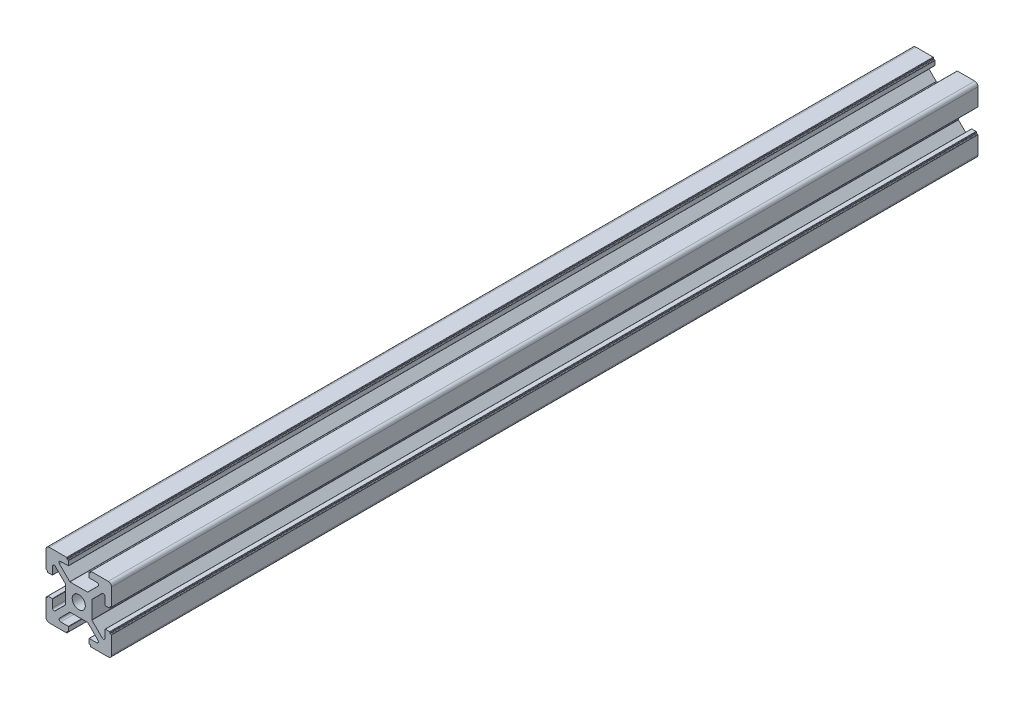
from build123d import *

# Parameters (mm, degrees)
SKETCH1_R           = 2
BOSS_EXTRUDE1_DEPTH = 264.5


with BuildPart() as part:
    # Sketch1 → Boss-Extrude1 (new body)
    with BuildSketch(Plane.XY):
        with BuildLine():
            Line((-10, 9), (-10, 3.7))
            ThreePointArc((-10, 3.7), (-9.970710678, 3.629289322), (-9.9, 3.6))
            Line((-9.9, 3.6), (-9.6, 3.6))
            ThreePointArc((-9.6, 3.6), (-9.529289322, 3.570710678), (-9.5, 3.5))
            Line((-9.5, 3.5), (-9.5, 3.2))
            ThreePointArc((-9.5, 3.2), (-9.470710678, 3.129289322), (-9.4, 3.1))
            Line((-9.4, 3.1), (-8.1, 3.1))
            ThreePointArc((-8.1, 3.1), (-8.029289322, 3.129289322), (-8, 3.2))
            Line((-8, 3.2), (-8, 5.520101013))
            ThreePointArc((-8, 5.520101013), (-7.691341716, 5.982040779), (-7.146446609, 5.873654403))
            Line((-7.146446609, 5.873654403), (-4.029289322, 2.756497116))
            ThreePointArc((-4.029289322, 2.756497116), (-4.007612047, 2.724054781), (-4, 2.685786438))
            Line((-4, 2.685786438), (-4, 0))
            Line((-4, 0), (-4, -2.685786438))
            ThreePointArc((-4, -2.685786438), (-4.007612047, -2.724054781), (-4.029289322, -2.756497116))
            Line((-4.029289322, -2.756497116), (-7.146446609, -5.873654403))
            ThreePointArc((-7.146446609, -5.873654403), (-7.691341716, -5.982040779), (-8, -5.520101013))
            Line((-8, -5.520101013), (-8, -3.2))
            ThreePointArc((-8, -3.2), (-8.029289322, -3.129289322), (-8.1, -3.1))
            Line((-8.1, -3.1), (-9.4, -3.1))
            ThreePointArc((-9.4, -3.1), (-9.470710678, -3.129289322), (-9.5, -3.2))
            Line((-9.5, -3.2), (-9.5, -3.5))
            ThreePointArc((-9.5, -3.5), (-9.529289322, -3.570710678), (-9.6, -3.6))
            Line((-9.6, -3.6), (-9.9, -3.6))
            ThreePointArc((-9.9, -3.6), (-9.970710678, -3.629289322), (-10, -3.7))
            Line((-10, -3.7), (-10, -9))
            ThreePointArc((-10, -9), (-9.707106781, -9.707106781), (-9, -10))
            Line((-9, -10), (-3.7, -10))
            ThreePointArc((-3.7, -10), (-3.629289322, -9.970710678), (-3.6, -9.9))
            Line((-3.6, -9.9), (-3.6, -9.6))
            ThreePointArc((-3.6, -9.6), (-3.570710678, -9.529289322), (-3.5, -9.5))
            Line((-3.5, -9.5), (-3.2, -9.5))
            ThreePointArc((-3.2, -9.5), (-3.129289322, -9.470710678), (-3.1, -9.4))
            Line((-3.1, -9.4), (-3.1, -8.1))
            ThreePointArc((-3.1, -8.1), (-3.129289322, -8.029289322), (-3.2, -8))
            Line((-3.2, -8), (-5.520101013, -8))
            ThreePointArc((-5.520101013, -8), (-5.982040779, -7.691341716), (-5.873654403, -7.146446609))
            Line((-5.873654403, -7.146446609), (-2.756497116, -4.029289322))
            ThreePointArc((-2.756497116, -4.029289322), (-2.724054781, -4.007612047), (-2.685786438, -4))
            Line((-2.685786438, -4), (2.685786438, -4))
            ThreePointArc((2.685786438, -4), (2.724054781, -4.007612047), (2.756497116, -4.029289322))
            Line((2.756497116, -4.029289322), (5.873654403, -7.146446609))
            ThreePointArc((5.873654403, -7.146446609), (5.982040779, -7.691341716), (5.520101013, -8))
            Line((5.520101013, -8), (3.2, -8))
            ThreePointArc((3.2, -8), (3.129289322, -8.029289322), (3.1, -8.1))
            Line((3.1, -8.1), (3.1, -9.4))
            ThreePointArc((3.1, -9.4), (3.129289322, -9.470710678), (3.2, -9.5))
            Line((3.2, -9.5), (3.5, -9.5))
            ThreePointArc((3.5, -9.5), (3.570710678, -9.529289322), (3.6, -9.6))
            Line((3.6, -9.6), (3.6, -9.9))
            ThreePointArc((3.6, -9.9), (3.629289322, -9.970710678), (3.7, -10))
            Line((3.7, -10), (9, -10))
            ThreePointArc((9, -10), (9.707106781, -9.707106781), (10, -9))
            Line((10, -9), (10, -3.7))
            ThreePointArc((10, -3.7), (9.970710678, -3.629289322), (9.9, -3.6))
            Line((9.9, -3.6), (9.6, -3.6))
            ThreePointArc((9.6, -3.6), (9.529289322, -3.570710678), (9.5, -3.5))
            Line((9.5, -3.5), (9.5, -3.2))
            ThreePointArc((9.5, -3.2), (9.470710678, -3.129289322), (9.4, -3.1))
            Line((9.4, -3.1), (8.1, -3.1))
            ThreePointArc((8.1, -3.1), (8.029289322, -3.129289322), (8, -3.2))
            Line((8, -3.2), (8, -5.520101013))
            ThreePointArc((8, -5.520101013), (7.691341716, -5.982040779), (7.146446609, -5.873654403))
            Line((7.146446609, -5.873654403), (4.029289322, -2.756497116))
            ThreePointArc((4.029289322, -2.756497116), (4.007612047, -2.724054781), (4, -2.685786438))
            Line((4, -2.685786438), (4, 0))
            Line((4, 0), (4, 2.685786438))
            ThreePointArc((4, 2.685786438), (4.007612047, 2.724054781), (4.029289322, 2.756497116))
            Line((4.029289322, 2.756497116), (7.146446609, 5.873654403))
            ThreePointArc((7.146446609, 5.873654403), (7.691341716, 5.982040779), (8, 5.520101013))
            Line((8, 5.520101013), (8, 3.2))
            ThreePointArc((8, 3.2), (8.029289322, 3.129289322), (8.1, 3.1))
            Line((8.1, 3.1), (9.4, 3.1))
            ThreePointArc((9.4, 3.1), (9.470710678, 3.129289322), (9.5, 3.2))
            Line((9.5, 3.2), (9.5, 3.5))
            ThreePointArc((9.5, 3.5), (9.529289322, 3.570710678), (9.6, 3.6))
            Line((9.6, 3.6), (9.9, 3.6))
            ThreePointArc((9.9, 3.6), (9.970710678, 3.629289322), (10, 3.7))
            Line((10, 3.7), (10, 9))
            ThreePointArc((10, 9), (9.707106781, 9.707106781), (9, 10))
            Line((9, 10), (3.7, 10))
            ThreePointArc((3.7, 10), (3.629289322, 9.970710678), (3.6, 9.9))
            Line((3.6, 9.9), (3.6, 9.6))
            ThreePointArc((3.6, 9.6), (3.570710678, 9.529289322), (3.5, 9.5))
            Line((3.5, 9.5), (3.2, 9.5))
            ThreePointArc((3.2, 9.5), (3.129289322, 9.470710678), (3.1, 9.4))
            Line((3.1, 9.4), (3.1, 8.1))
            ThreePointArc((3.1, 8.1), (3.129289322, 8.029289322), (3.2, 8))
            Line((3.2, 8), (5.520101013, 8))
            ThreePointArc((5.520101013, 8), (5.982040779, 7.691341716), (5.873654403, 7.146446609))
            Line((5.873654403, 7.146446609), (2.756497116, 4.029289322))
            ThreePointArc((2.756497116, 4.029289322), (2.724054781, 4.007612047), (2.685786438, 4))
            Line((2.685786438, 4), (-2.685786438, 4))
            ThreePointArc((-2.685786438, 4), (-2.724054781, 4.007612047), (-2.756497116, 4.029289322))
            Line((-2.756497116, 4.029289322), (-5.873654403, 7.146446609))
            ThreePointArc((-5.873654403, 7.146446609), (-5.982040779, 7.691341716), (-5.520101013, 8))
            Line((-5.520101013, 8), (-3.2, 8))
            ThreePointArc((-3.2, 8), (-3.129289322, 8.029289322), (-3.1, 8.1))
            Line((-3.1, 8.1), (-3.1, 9.4))
            ThreePointArc((-3.1, 9.4), (-3.129289322, 9.470710678), (-3.2, 9.5))
            Line((-3.2, 9.5), (-3.5, 9.5))
            ThreePointArc((-3.5, 9.5), (-3.570710678, 9.529289322), (-3.6, 9.6))
            Line((-3.6, 9.6), (-3.6, 9.9))
            ThreePointArc((-3.6, 9.9), (-3.629289322, 9.970710678), (-3.7, 10))
            Line((-3.7, 10), (-9, 10))
            ThreePointArc((-9, 10), (-9.707106781, 9.707106781), (-10, 9))
        make_face()
        Circle(SKETCH1_R, mode=Mode.SUBTRACT)
    extrude(amount=BOSS_EXTRUDE1_DEPTH)


solid = part.part
